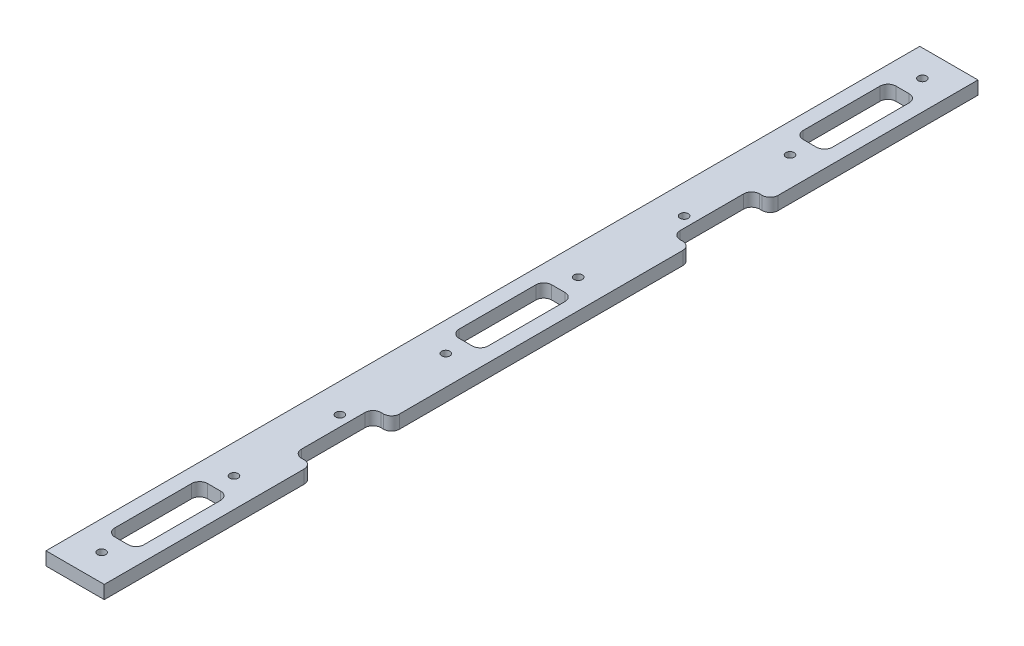
from build123d import *

# Parameters (mm, degrees)
SKETCH_1_W          = 22
SKETCH_1_H          = 330
SKETCH_1_R          = 1.55
EXTRUDE_1_DEPTH     = 5
SKETCH_2_W          = 14
SKETCH_2_H          = 30
CUT_EXTRUDE_1_DEPTH = 166.441832678
FILLET_1_R          = 3
SKETCH_3_W          = 11
SKETCH_3_H          = 35
CUT_EXTRUDE_2_DEPTH = 166.441832678
FILLET_2_R          = 3


with BuildPart() as part:
    # 草图1 → 凸台-拉伸1 (new body)
    with BuildSketch(Plane(origin=(0, 0, 0), x_dir=(1, 0, 0), z_dir=(0, 1, 0))):
        Rectangle(SKETCH_1_W, SKETCH_1_H)
        with Locations(Location((0, 25, 0), (0, 0, 270))):
            Circle(SKETCH_1_R, mode=Mode.SUBTRACT)
        with Locations(Location((0, 65, 0), (0, 0, 270))):
            Circle(SKETCH_1_R, mode=Mode.SUBTRACT)
        with Locations(Location((0, -25, 0), (0, 0, 90))):
            Circle(SKETCH_1_R, mode=Mode.SUBTRACT)
        with Locations(Location((0, -65, 0), (0, 0, 90))):
            Circle(SKETCH_1_R, mode=Mode.SUBTRACT)
        with Locations(Location((0, 105, 0), (0, 0, 270))):
            Circle(SKETCH_1_R, mode=Mode.SUBTRACT)
        with Locations(Location((0, 155, 0), (0, 0, 270))):
            Circle(SKETCH_1_R, mode=Mode.SUBTRACT)
        with Locations(Location((0, -155, 0), (0, 0, 90))):
            Circle(SKETCH_1_R, mode=Mode.SUBTRACT)
        with Locations(Location((0, -105, 0), (0, 0, 90))):
            Circle(SKETCH_1_R, mode=Mode.SUBTRACT)
    extrude(amount=EXTRUDE_1_DEPTH)

    # 草图2 → 切除-拉伸1 (cut, through all)
    with BuildSketch(Plane(origin=(0, 5, 0), x_dir=(1, 0, 0), z_dir=(0, 1, 0))):
        with Locations((11, 71.5)):
            Rectangle(SKETCH_2_W, SKETCH_2_H)
        with Locations((11, -71.5)):
            Rectangle(SKETCH_2_W, SKETCH_2_H)
    extrude(amount=-CUT_EXTRUDE_1_DEPTH, mode=Mode.SUBTRACT)

    # 圆角1
    fillet_1_edges = [part.edges().sort_by_distance(p)[0] for p in [
        (11, 2.5, 86.5),
        (11, 2.5, 56.5),
        (11, 2.5, -86.5),
        (11, 2.5, -56.5),
        (4, 2.5, -86.5),
        (4, 2.5, -56.5),
        (4, 2.5, 56.5),
        (4, 2.5, 86.5),
    ]]
    fillet(fillet_1_edges, radius=FILLET_1_R)

    # 草图3 → 切除-拉伸2 (cut, through all)
    with BuildSketch(Plane(origin=(0, 5, 0), x_dir=(1, 0, 0), z_dir=(0, 1, 0))):
        with Locations((0, 130)):
            Rectangle(SKETCH_3_W, SKETCH_3_H)
        with Locations((0, -130)):
            Rectangle(SKETCH_3_W, SKETCH_3_H)
        Rectangle(SKETCH_3_W, SKETCH_3_H)
    extrude(amount=-CUT_EXTRUDE_2_DEPTH, mode=Mode.SUBTRACT)

    # 圆角2
    fillet_2_edges = [part.edges().sort_by_distance(p)[0] for p in [
        (5.5, 2.5, -147.5),
        (5.5, 2.5, -112.5),
        (-5.5, 2.5, -112.5),
        (-5.5, 2.5, -147.5),
        (-5.5, 2.5, 147.5),
        (-5.5, 2.5, 112.5),
        (5.5, 2.5, 112.5),
        (5.5, 2.5, 147.5),
        (5.5, 2.5, -17.5),
        (5.5, 2.5, 17.5),
        (-5.5, 2.5, 17.5),
        (-5.5, 2.5, -17.5),
    ]]
    fillet(fillet_2_edges, radius=FILLET_2_R)


solid = part.part
